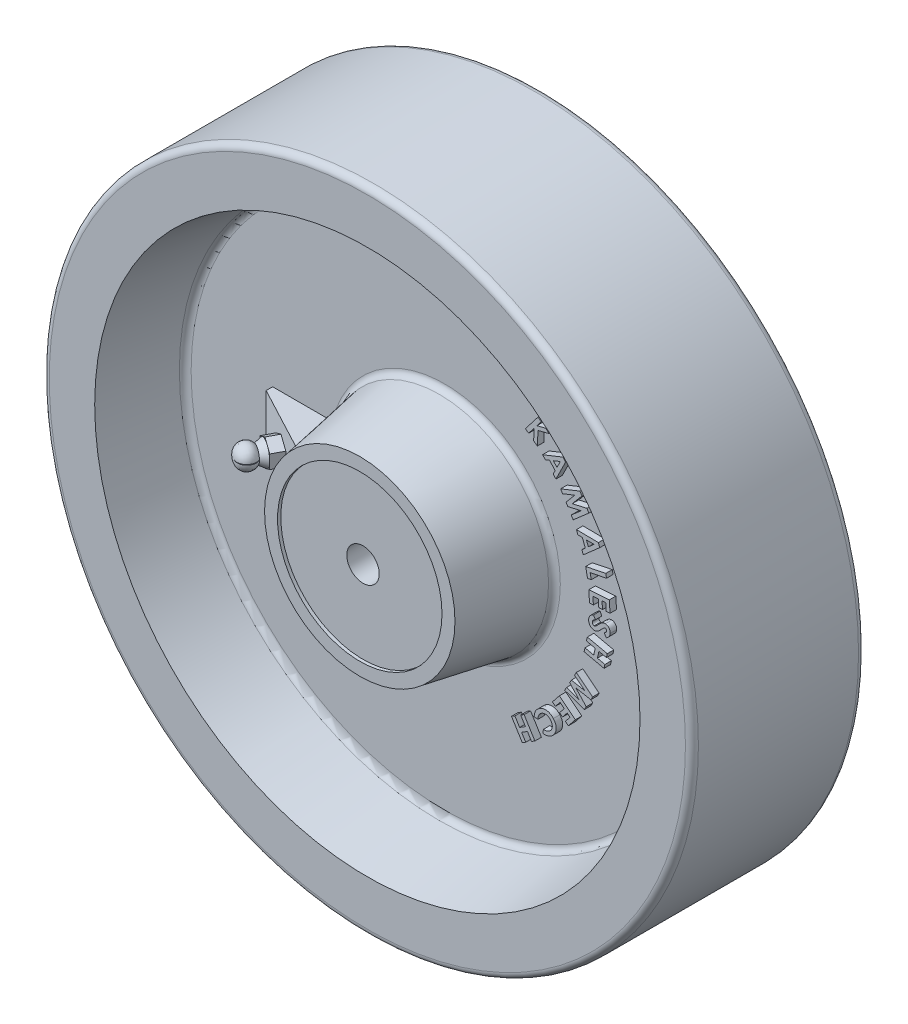
from build123d import *

# Parameters (mm, degrees)
SKETCH1_R           = 150
SKETCH1_R_2         = 138
BOSS_EXTRUDE1_DEPTH = 80
FILLET1_R           = 3
BOSS_EXTRUDE2_DEPTH = 12.5
BOSS_EXTRUDE3_DEPTH = 5.5
SKETCH6_R           = 5.419048207
BOSS_EXTRUDE4_DEPTH = 3
BOSS_EXTRUDE4_TAPER = 30
REVOLVE10_ANGLE     = 197
REVOLVE16_ANGLE     = 160
FILLET2_R           = 3
SKETCH9_R           = 7.5
CUT_EXTRUDE1_DEPTH  = 200
BOSS_EXTRUDE5_DEPTH = 3
SCALE1_SCALE        = 0.25


with BuildPart() as part:
    # Sketch1 → Boss-Extrude1 (new body)
    with BuildSketch(Plane.XY):
        Circle(SKETCH1_R)
        Circle(SKETCH1_R_2, mode=Mode.SUBTRACT)
    extrude(amount=BOSS_EXTRUDE1_DEPTH)

    # Fillet1
    fillet1_edges = [part.edges().sort_by_distance(p)[0] for p in [
        (-150, 0, 0),
        (-150, 0, 80),
    ]]
    fillet(fillet1_edges, radius=FILLET1_R)

    # Sketch2 → Revolve1 (revolve)
    with BuildSketch(Plane(origin=(0, 0, 0), x_dir=(1, 0, 0), z_dir=(0, 1, 0)), mode=Mode.PRIVATE) as revolve1_sk:
        Polygon((0, 2), (0, -82), (-38, -82), (-38, -83.5), (-44, -83.5), (-50.920833993, -44.25), (-119.69631044, -44.25), (-126, -80), (-138, -80), (-138, 0), (-126, 0), (-119.69631044, -35.75), (-50.920833993, -35.75), (-44, 3.5), (-38, 3.5), (-38, 2), align=None)
    revolve(revolve1_sk.sketch.rotate(Axis((0, 0, 132.461100462), (0, 0, -1)), 180), axis=Axis((0, 0, 132.461100462), (0, 0, -1)))

    # Sketch4 → Boss-Extrude2 (add, symmetric)
    with BuildSketch(Plane(origin=(0, 0, 0), x_dir=(1, 0, 0), z_dir=(0, 1, 0))):
        Polygon((-44.526638001, -64.25), (-44.526638001, -44.25), (-79.526638001, -44.25), (-79.526638001, -47.25), (-47.526638001, -64.25), align=None)
    extrude(amount=BOSS_EXTRUDE2_DEPTH, both=True)

    # Sketch5 → Boss-Extrude3 (add)
    with BuildSketch(Plane(origin=(-37.080882241, 0, 69.799307748), x_dir=(0.8831157194574106, 0, 0.46915522596174936), z_dir=(-0.4691552259617493, 0, 0.8831157194574105))):
        Polygon((-31.46224282, -6.257377882), (-26.043194613, -3.128688941), (-26.043194613, 3.128688941), (-31.46224282, 6.257377882), (-36.881291027, 3.128688941), (-36.881291027, -3.128688941), align=None)
    extrude(amount=BOSS_EXTRUDE3_DEPTH)

    # Sketch6 → Boss-Extrude4 (add)
    with BuildSketch(Plane(origin=(-39.661235984, 0, 74.656444205), x_dir=(0.8831157194574106, 0, 0.4691552259617493), z_dir=(-0.4691552259617493, 0, 0.8831157194574106))):
        with Locations((-31.46224282, 0)):
            Circle(SKETCH6_R)
    extrude(amount=BOSS_EXTRUDE4_DEPTH, taper=BOSS_EXTRUDE4_TAPER)

    # Sketch7 → Revolve10 (revolve)
    with BuildSketch(Plane(origin=(0, 0, 0), x_dir=(1, 0, 0), z_dir=(0, 1, 0))):
        with BuildLine():
            Line((-72.53953199, -69.42641392), (-68.871282287, -62.562602657))
            Line((-68.871282287, -62.562602657), (-65.597457504, -64.274889822))
            ThreePointArc((-65.597457504, -64.274889822), (-67.072987515, -69.53975117), (-72.53953199, -69.42641392))
        make_face()
    revolve(axis=Axis((-72.53953199, 0, 69.42641392), (0.4713433829073323, 0, -0.8819497805371187)), revolution_arc=REVOLVE10_ANGLE)

    # Sketch8 → Revolve16 (revolve)
    with BuildSketch(Plane(origin=(-2.356133559, -8.738100275, -1.25919637), x_dir=(0.9661830492283396, -0.2552208191231726, -0.036778375031050574), z_dir=(0.25785716081549453, 0.9563047559630309, 0.13780746837040567))):
        with BuildLine():
            Line((-70.673298822, -60.878690402), (-72.048151549, -60.114622764))
            Line((-72.048151549, -60.114622764), (-72.048489072, -60.093988268))
            Line((-72.048489072, -60.093988268), (-72.052128514, -60.091911553))
            ThreePointArc((-72.052128514, -60.091911553), (-75.686871824, -64.176589619), (-72.639856896, -68.716595551))
            Line((-72.639856896, -68.716595551), (-68.843216388, -61.922960162))
            Line((-68.843216388, -61.922960162), (-70.673298822, -60.878690402))
        make_face()
    revolve(axis=Axis((-72.53953199, 0, 69.42641392), (0.47134338290733374, 0, -0.881949780537118)), revolution_arc=REVOLVE16_ANGLE)

    # Fillet2
    fillet2_edges = [part.edges().sort_by_distance(p)[0] for p in [
        (-50.920833993, 0, 35.75),
        (-119.69631044, 0, 35.75),
        (6.298365223, 50.52981229, 44.25),
        (-119.69631044, 0, 44.25),
    ]]
    fillet(fillet2_edges, radius=FILLET2_R)

    # Sketch9 → Cut-Extrude1 (cut)
    with BuildSketch(Plane.XY.offset(82)):
        Circle(SKETCH9_R)
    extrude(amount=-CUT_EXTRUDE1_DEPTH, mode=Mode.SUBTRACT)

    # Sketch10 → Boss-Extrude5 (add)
    # profile 1 of 12: a face of its own
    with BuildSketch(Plane.XY.offset(44.25)):
        Polygon((46.12988392, 64.697056438), (47.580004112, 63.5808455), (45.580364689, 60.985893577), (49.627344857, 62.002885765), (51.354132718, 60.672972904), (46.127975867, 59.339243938), (45.801698823, 52.932002351), (44.09971565, 54.242834683), (44.349670578, 59.38694526), (41.769983078, 56.038312448), (40.319862886, 57.154523385), align=None)
    # profile 2 of 12: a face of its own
    with BuildSketch(Plane.XY.offset(44.25)):
        Polygon((57.636391852, 54.418739282), (58.868994015, 53.08119421), (54.40033416, 44.019851061), (53.135295097, 45.389833032), (54.062608799, 47.248276542), (51.454300506, 50.074102864), (49.504270458, 49.32423808), (48.241139448, 50.694220051), align=None)
        Polygon((56.422870217, 52.045121494), (53.192536684, 50.77245022), (54.892611804, 48.929271133), align=None, mode=Mode.SUBTRACT)
    # profile 3 of 12: a face of its own
    with BuildSketch(Plane.XY.offset(44.25)):
        Polygon((65.484975331, 44.740310882), (66.406564874, 43.236765209), (61.920732542, 37.922837925), (68.707676653, 39.479809079), (69.615909826, 37.997251987), (62.380573288, 31.693045257), (61.472340115, 33.175602348), (66.038310667, 37.16534093), (59.88865622, 35.759105954), (59.058653215, 37.113823502), (63.117081701, 41.931657035), (57.48069348, 39.691602949), (56.562920042, 41.189424463), align=None)
    # profile 4 of 12: a face of its own
    with BuildSketch(Plane.XY.offset(44.25)):
        Polygon((74.010946831, 28.415197085), (74.644420389, 26.703673647), (67.046553802, 20.01785634), (66.397815821, 21.769448888), (67.966235292, 23.137522806), (66.62869022, 26.751374969), (64.537464259, 26.799076291), (63.888726278, 28.55066884), align=None)
        Polygon((71.984594667, 26.676960907), (68.506214259, 26.734202493), (69.376286374, 24.379665234), align=None, mode=Mode.SUBTRACT)
    # profile 5 of 12: a face of its own
    with BuildSketch(Plane.XY.offset(44.25)):
        Polygon((77.431473008, 17.800497905), (77.795911109, 16.031732881), (70.184688152, 14.469037569), (70.713218801, 11.889350069), (69.026500051, 11.542084444), (68.133531301, 15.890536968), align=None)
    # profile 6 of 12: a face of its own
    with BuildSketch(Plane.XY.offset(44.25)):
        Polygon((79.045425857, 7.995475657), (79.415588117, 2.822744287), (77.650639199, 2.696812796), (77.408316482, 6.077882508), (75.694884992, 5.95385907), (75.937207708, 2.572789359), (74.204695689, 2.448765921), (73.962372973, 5.829835633), (71.470455906, 5.652386715), (71.712778622, 2.271317003), (69.942105545, 2.14347746), (69.571943285, 7.31620883), align=None)
    # profile 7 of 12: a face of its own
    with BuildSketch(Plane.XY.offset(44.25)):
        with BuildLine():
            Line((77.771690175, -7.845774784), (76.682191978, -6.435723702))
            add(Edge.make_bspline(
                [(76.682191978, -6.435723702), (76.763141698, -6.383467816), (76.919152498, -6.282757368), (77.130619596, -6.119096653), (77.312618114, -5.952873619), (77.461815025, -5.781934871), (77.58544213, -5.610544167), (77.672657971, -5.43264833), (77.736542383, -5.253581525), (77.749843763, -5.130475177), (77.756425752, -5.069557836)],
                knots=[0, 0, 0, 0, 1.281906111, 2.470560694, 3.55479556, 4.556585826, 5.486560015, 6.357279143, 7.187124073, 8, 8, 8, 8], degree=3))
            add(Edge.make_bspline(
                [(77.756425752, -5.069557836), (77.758594198, -5.012825071), (77.762765435, -4.903693558), (77.733748055, -4.746622977), (77.685768005, -4.60228212), (77.608359597, -4.477839339), (77.518149358, -4.374034769), (77.419441451, -4.291457772), (77.308586513, -4.239686266), (77.230275276, -4.229376508), (77.191642098, -4.224290409)],
                knots=[0, 0, 0, 0, 1.209038723, 2.325714675, 3.39122673, 4.439628025, 5.431311472, 6.320253696, 7.17133301, 8, 8, 8, 8], degree=3))
            add(Edge.make_bspline(
                [(77.191642098, -4.224290409), (77.152080777, -4.223376774), (77.072855376, -4.221547132), (76.955194349, -4.247015021), (76.837972445, -4.287971757), (76.766673949, -4.332813576), (76.7298933, -4.355946058)],
                knots=[0, 0, 0, 0, 0.968199431, 1.938913669, 2.936750471, 4, 4, 4, 4], degree=3))
            add(Edge.make_bspline(
                [(76.7298933, -4.355946058), (76.701017801, -4.376604631), (76.633913829, -4.424613233), (76.52689646, -4.515279852), (76.395834694, -4.629667088), (76.246678348, -4.774632093), (76.070993517, -4.941041172), (75.873633474, -5.134258703), (75.657410053, -5.356250261), (75.504947201, -5.512250444), (75.424785127, -5.59427238)],
                knots=[0, 0, 0, 0, 0.472993008, 1.099191739, 1.867856494, 2.7911666, 3.87026272, 5.092995224, 6.471552054, 8, 8, 8, 8], degree=3))
            add(Edge.make_bspline(
                [(75.424785127, -5.59427238), (75.351016653, -5.671239451), (75.210641858, -5.817700891), (75.01098989, -6.025717583), (74.831758144, -6.208404175), (74.674564941, -6.367304826), (74.540134284, -6.503221241), (74.42481166, -6.613000913), (74.334355647, -6.702051193), (74.278856451, -6.750741738), (74.255148709, -6.77154101)],
                knots=[0, 0, 0, 0, 1.541485479, 2.933308739, 4.168892309, 5.241859356, 6.165244342, 6.932674467, 7.544067657, 8, 8, 8, 8], degree=3))
            add(Edge.make_bspline(
                [(74.255148709, -6.77154101), (74.15892425, -6.85115912), (73.974316654, -7.003907269), (73.691665376, -7.201477225), (73.417444297, -7.359924396), (73.148921673, -7.481751061), (72.877926762, -7.56455767), (72.601693016, -7.617803455), (72.315710809, -7.644396393), (72.122606475, -7.636220768), (72.024634887, -7.63207286)],
                knots=[0, 0, 0, 0, 1.21794336, 2.336636635, 3.359343804, 4.303619165, 5.20631811, 6.116448548, 7.044379151, 8, 8, 8, 8], degree=3))
            add(Edge.make_bspline(
                [(72.024634887, -7.63207286), (71.929544889, -7.624100002), (71.742982045, -7.608457567), (71.473013865, -7.547787299), (71.214727761, -7.471819066), (70.972575076, -7.365214779), (70.742617403, -7.237910907), (70.531509003, -7.080856045), (70.330277015, -6.904708638), (70.14706769, -6.703490769), (69.983427144, -6.482939142), (69.843291507, -6.247041165), (69.728385711, -5.997618712), (69.637906701, -5.734299172), (69.574420471, -5.457187486), (69.531249811, -5.167025756), (69.51632392, -4.86285523), (69.525913597, -4.65611971), (69.530809767, -4.550567452)],
                knots=[0, 0, 0, 0, 1.028480388, 2.017838153, 2.979578233, 3.929416991, 4.86667587, 5.80974633, 6.76270411, 7.748819165, 8.739865599, 9.721504437, 10.704150403, 11.69818657, 12.720327328, 13.767596371, 14.860209194, 16, 16, 16, 16], degree=3))
            add(Edge.make_bspline(
                [(69.530809767, -4.550567452), (69.538136488, -4.467785087), (69.552562333, -4.30479193), (69.590212299, -4.064685468), (69.646500042, -3.834382956), (69.714062623, -3.612526116), (69.798979306, -3.400925006), (69.899028132, -3.198837965), (70.010079008, -3.002973909), (70.142034379, -2.819506832), (70.287284872, -2.642884906), (70.449633348, -2.474680715), (70.631080686, -2.315729124), (70.828384033, -2.163612519), (71.04418511, -2.020623348), (71.274785304, -1.882102149), (71.524921889, -1.755316756), (71.699270741, -1.678160851), (71.788036329, -1.63887875)],
                knots=[0, 0, 0, 0, 1.02030464, 2.00891428, 2.980630281, 3.929160724, 4.854386028, 5.776441839, 6.696676876, 7.615419504, 8.547344192, 9.502825546, 10.482137711, 11.506826417, 12.559494208, 13.659088357, 14.808180281, 16, 16, 16, 16], degree=3))
            Line((71.788036329, -1.63887875), (72.600866858, -3.214930433))
            add(Edge.make_bspline(
                [(72.600866858, -3.214930433), (72.498254693, -3.264841583), (72.301928643, -3.36033571), (72.033180427, -3.522928424), (71.802070121, -3.693756459), (71.610595871, -3.876171609), (71.457142614, -4.06825595), (71.342851966, -4.270079802), (71.26661308, -4.482053791), (71.249153915, -4.628224922), (71.240425151, -4.70130363)],
                knots=[0, 0, 0, 0, 1.293606771, 2.475035081, 3.557038834, 4.54676838, 5.466040082, 6.334823143, 7.16748969, 8, 8, 8, 8], degree=3))
            add(Edge.make_bspline(
                [(71.240425151, -4.70130363), (71.238262014, -4.775890247), (71.234050079, -4.921120989), (71.274605365, -5.131441005), (71.345007393, -5.326960241), (71.451645277, -5.50014442), (71.581403017, -5.646802478), (71.728460511, -5.758022116), (71.889793293, -5.83398882), (72.004784179, -5.84967178), (72.062795944, -5.857583678)],
                knots=[0, 0, 0, 0, 1.138592256, 2.217000917, 3.254595354, 4.302677918, 5.308810827, 6.233275046, 7.108704736, 8, 8, 8, 8], degree=3))
            add(Edge.make_bspline(
                [(72.062795944, -5.857583678), (72.117020213, -5.858397777), (72.227279979, -5.860053169), (72.394001207, -5.822745401), (72.560902862, -5.756093615), (72.701395366, -5.678312221), (72.818771087, -5.59458627), (72.92147758, -5.514638911), (73.035724366, -5.416869174), (73.161523697, -5.302142014), (73.298850151, -5.170346768), (73.447540322, -5.020709404), (73.609807926, -4.855379582), (73.720479578, -4.737769515), (73.778135488, -4.676498942)],
                knots=[0, 0, 0, 0, 0.907128202, 1.844556818, 2.841137064, 3.915758705, 4.528468584, 5.258350298, 6.098507244, 7.050156569, 8.11413286, 9.29103176, 10.588725961, 12, 12, 12, 12], degree=3))
            add(Edge.make_bspline(
                [(73.778135488, -4.676498942), (73.88754572, -4.559509237), (74.097723013, -4.334771759), (74.410272286, -4.020693717), (74.698655798, -3.735202277), (74.96935732, -3.485366504), (75.219591834, -3.269162128), (75.448419506, -3.084586495), (75.657747818, -2.933188463), (75.905380356, -2.777378481), (76.202253662, -2.629827793), (76.557052021, -2.510069223), (76.909302218, -2.44406936), (77.141790585, -2.44790732), (77.256515896, -2.449801226)],
                knots=[0, 0, 0, 0, 1.351397201, 2.596036942, 3.738257078, 4.775013305, 5.703402554, 6.52807202, 7.25482739, 7.881677223, 8.995237569, 10.042275653, 11.033927856, 12, 12, 12, 12], degree=3))
            add(Edge.make_bspline(
                [(77.256515896, -2.449801226), (77.336947903, -2.456767148), (77.496035732, -2.470545163), (77.727440947, -2.524853635), (77.950584127, -2.595404517), (78.160907007, -2.695241977), (78.363439162, -2.812649265), (78.551920433, -2.958127095), (78.733267076, -3.122844739), (78.900403803, -3.310233391), (79.052551119, -3.512718252), (79.183223479, -3.727347836), (79.290006501, -3.952149053), (79.377266936, -4.185264789), (79.437749228, -4.428694814), (79.475294296, -4.681018843), (79.494378181, -4.942828125), (79.485712331, -5.120436209), (79.48130556, -5.21075375)],
                knots=[0, 0, 0, 0, 0.980880199, 1.940099567, 2.884539061, 3.822650528, 4.76610704, 5.727072259, 6.712822797, 7.742823146, 8.776507518, 9.790280839, 10.793875962, 11.799973225, 12.813303573, 13.838614598, 14.900888918, 16, 16, 16, 16], degree=3))
            add(Edge.make_bspline(
                [(79.48130556, -5.21075375), (79.469630412, -5.327619725), (79.446471478, -5.559436192), (79.359236002, -5.899558674), (79.233537377, -6.228241796), (79.093512464, -6.492007363), (78.960750855, -6.699466322), (78.840444099, -6.856234539), (78.705301203, -7.01649591), (78.552173426, -7.178660837), (78.381304958, -7.342566108), (78.195300492, -7.510606079), (77.989721645, -7.678388969), (77.845759874, -7.788910438), (77.771690175, -7.845774784)],
                knots=[0, 0, 0, 0, 1.298415062, 2.575548552, 3.872474189, 5.185615111, 5.872958805, 6.596653783, 7.370933703, 8.192660428, 9.06391689, 9.99113918, 10.966422031, 12, 12, 12, 12], degree=3))
        make_face()
    # profile 8 of 12: a face of its own
    with BuildSketch(Plane.XY.offset(44.25)):
        Polygon((78.123514967, -13.992439816), (77.726639967, -15.770745104), (74.252075664, -14.99416758), (73.563268573, -18.073764936), (77.037832876, -18.85034246), (76.640957876, -20.62292359), (67.430786602, -18.564134528), (67.827661602, -16.791553398), (71.865101506, -17.694062412), (72.553908597, -14.614465056), (68.516468693, -13.711956042), (68.913343693, -11.933650754), align=None)
    # profile 9 of 12: a face of its own
    with BuildSketch(Plane.XY.offset(44.25)):
        Polygon((71.372056092, -34.667732225), (70.522972558, -36.220887273), (63.657798279, -34.965388475), (68.399309698, -40.099958787), (67.561674481, -41.630217201), (58.460262222, -38.474297729), (59.297897438, -36.945947369), (65.048768832, -38.932230422), (60.757557895, -34.276581383), (61.524595154, -32.877978619), (67.744847558, -34.009453979), (62.980439505, -30.216244845), (63.827614986, -28.668813955), align=None)
    # profile 10 of 12: a face of its own
    with BuildSketch(Plane.XY.offset(44.25)):
        Polygon((63.382466431, -47.804229212), (60.161673162, -51.826404693), (58.789783138, -50.727366232), (60.898181576, -48.096161304), (59.566360662, -47.029559741), (57.457962225, -49.660764669), (56.110876888, -48.582714789), (58.219275326, -45.951509861), (56.280693595, -44.398354813), (54.172295157, -47.029559741), (52.794680975, -45.926705174), (56.015474244, -41.904529693), align=None)
    # profile 11 of 12: a face of its own
    with BuildSketch(Plane.XY.offset(44.25)):
        with BuildLine():
            Line((48.44947647, -60.788372142), (48.583040172, -59.055860123))
            add(Edge.make_bspline(
                [(48.583040172, -59.055860123), (48.734378677, -59.06439973), (49.030127208, -59.08108799), (49.46501119, -59.058225708), (49.880121168, -59.002926809), (50.274149477, -58.905387179), (50.647765061, -58.768996451), (50.999291662, -58.594594156), (51.332634668, -58.384315665), (51.53288095, -58.214375758), (51.634016734, -58.128546421)],
                knots=[0, 0, 0, 0, 1.107709041, 2.164705692, 3.178946563, 4.165960249, 5.126765548, 6.081472872, 7.031034468, 8, 8, 8, 8], degree=3))
            add(Edge.make_bspline(
                [(51.634016734, -58.128546421), (51.714294663, -58.052339475), (51.872159097, -57.902480521), (52.081450439, -57.656999435), (52.259334848, -57.397125658), (52.411933311, -57.126937675), (52.529629945, -56.841022729), (52.622610983, -56.545145808), (52.682893386, -56.235385357), (52.715465418, -55.917287541), (52.716526527, -55.597320822), (52.691703304, -55.282520708), (52.630760877, -54.978055392), (52.543969383, -54.681846349), (52.421775804, -54.396043722), (52.270684378, -54.119701585), (52.091027272, -53.851053079), (51.948762574, -53.686443353), (51.876339451, -53.602644979)],
                knots=[0, 0, 0, 0, 1.050584987, 2.06594773, 3.056010854, 4.037396755, 5.006496499, 5.986469049, 6.977839163, 7.997646625, 9.018329989, 10.012400663, 10.990752791, 11.961432039, 12.938441096, 13.935698901, 14.949119946, 16, 16, 16, 16], degree=3))
            add(Edge.make_bspline(
                [(51.876339451, -53.602644979), (51.823506667, -53.54609613), (51.718753925, -53.433975463), (51.553390732, -53.278163358), (51.382671219, -53.135975422), (51.206799753, -53.00780396), (51.025204788, -52.89292878), (50.838192465, -52.792053744), (50.646564374, -52.703578709), (50.386854725, -52.605127375), (50.053011175, -52.518089623), (49.644077962, -52.465735997), (49.229277979, -52.480480003), (48.883969744, -52.534134789), (48.611344698, -52.608919122), (48.40777662, -52.674517376), (48.210478849, -52.75774913), (48.016093061, -52.850218158), (47.829682358, -52.960783956), (47.645827424, -53.080206193), (47.467628788, -53.21446946), (47.354334308, -53.312587243), (47.297012528, -53.362230315)],
                knots=[0, 0, 0, 0, 0.903366238, 1.791124441, 2.650606422, 3.495726035, 4.330076843, 5.157392751, 5.974751338, 6.792582017, 8.397376176, 9.99077406, 11.587904937, 13.227421668, 14.057797778, 14.886711722, 15.722383228, 16.555973687, 17.397824724, 18.250479178, 19.114823172, 20, 20, 20, 20], degree=3))
            add(Edge.make_bspline(
                [(47.297012528, -53.362230315), (47.203953528, -53.449900938), (47.021005722, -53.622255554), (46.786565467, -53.91162188), (46.585649431, -54.214432449), (46.449106874, -54.483018955), (46.35705865, -54.709779372), (46.296397187, -54.893454474), (46.242656296, -55.09085678), (46.198276766, -55.302032549), (46.157246159, -55.526421287), (46.125302914, -55.7652139), (46.101026331, -56.017957518), (46.089417198, -56.191203474), (46.083490893, -56.279643176)],
                knots=[0, 0, 0, 0, 1.411876372, 2.775655055, 4.105505268, 5.422920595, 6.097879533, 6.809310127, 7.559725302, 8.358137033, 9.193843264, 10.080738324, 11.020243049, 12, 12, 12, 12], degree=3))
            Line((46.083490893, -56.279643176), (44.326174186, -56.151803632))
            add(Edge.make_bspline(
                [(44.326174186, -56.151803632), (44.3349536, -56.032802286), (44.352115551, -55.800179101), (44.390068428, -55.460202541), (44.439255583, -55.137372083), (44.500504565, -54.831934237), (44.570925744, -54.543496057), (44.65024856, -54.271684728), (44.742247777, -54.017811922), (44.843931734, -53.777826028), (44.960311748, -53.549334167), (45.087759136, -53.325033698), (45.232356177, -53.105945987), (45.387475279, -52.887835035), (45.561122362, -52.675805886), (45.747004673, -52.466393987), (45.948561202, -52.261711683), (46.090002036, -52.129755856), (46.161721061, -52.062846301)],
                knots=[0, 0, 0, 0, 1.239904762, 2.423759092, 3.553868309, 4.632295093, 5.659819954, 6.638528824, 7.573058283, 8.46433111, 9.345152231, 10.236253501, 11.143676308, 12.07180344, 13.016282896, 13.989980056, 14.980798772, 16, 16, 16, 16], degree=3))
            add(Edge.make_bspline(
                [(46.161721061, -52.062846301), (46.29774278, -51.945844614), (46.564787496, -51.716140985), (46.992188016, -51.420629037), (47.428872487, -51.171765056), (47.877644239, -50.973939769), (48.337438209, -50.826047451), (48.807655406, -50.728834684), (49.287734968, -50.678281247), (49.774151036, -50.679749133), (50.258439123, -50.725322211), (50.730513118, -50.824466213), (51.186903454, -50.967233817), (51.6272143, -51.159501251), (52.049740949, -51.402198533), (52.457646848, -51.689676345), (52.849571201, -52.024375982), (53.088370146, -52.278629527), (53.210068417, -52.408203873)],
                knots=[0, 0, 0, 0, 1.086810029, 2.133680404, 3.143494199, 4.12903079, 5.100627712, 6.065294791, 7.034188605, 8.021013474, 9.008696263, 9.977137547, 10.93905115, 11.902292339, 12.882931674, 13.887167812, 14.923244722, 16, 16, 16, 16], degree=3))
            add(Edge.make_bspline(
                [(53.210068417, -52.408203873), (53.286202681, -52.495717827), (53.436578975, -52.668570674), (53.6410715, -52.940804116), (53.824224942, -53.218519859), (53.985336998, -53.503208375), (54.127058388, -53.792505838), (54.246376852, -54.08951265), (54.340342215, -54.393250102), (54.417579864, -54.700688773), (54.473126732, -55.011728283), (54.505765038, -55.325486788), (54.51476626, -55.641126179), (54.503301497, -55.957888288), (54.471013399, -56.276736732), (54.415005961, -56.596498273), (54.338828877, -56.918569824), (54.239364474, -57.238680867), (54.122378916, -57.554691914), (53.98418143, -57.860079113), (53.829793659, -58.155087836), (53.655698618, -58.438114404), (53.462402711, -58.70903102), (53.252622709, -58.96878521), (53.024480361, -59.21683458), (52.85998404, -59.371060337), (52.776940412, -59.448919017)],
                knots=[0, 0, 0, 0, 1.060556804, 2.094754633, 3.111116571, 4.10096807, 5.084303932, 6.055331274, 7.024824331, 7.989770022, 8.952767797, 9.911804956, 10.871987971, 11.838177567, 12.808786708, 13.80043103, 14.80493975, 15.833429535, 16.8641374, 17.88468506, 18.896793826, 19.90736372, 20.920942264, 21.938368874, 22.959214857, 24, 24, 24, 24], degree=3))
            add(Edge.make_bspline(
                [(52.776940412, -59.448919017), (52.703832519, -59.512690501), (52.558237057, -59.639692364), (52.328233839, -59.815546629), (52.089706674, -59.977495021), (51.843306359, -60.126716295), (51.588197599, -60.262288811), (51.325894184, -60.38686658), (51.053978425, -60.495066555), (50.775961005, -60.590852909), (50.492311332, -60.670420676), (50.205740208, -60.735359185), (49.917377277, -60.785693262), (49.626740065, -60.817542197), (49.335066961, -60.834736832), (49.041429545, -60.837038693), (48.745834247, -60.821834095), (48.548602057, -60.799564478), (48.44947647, -60.788372142)],
                knots=[0, 0, 0, 0, 0.996203305, 1.983953758, 2.971401757, 3.956145155, 4.940996879, 5.937457159, 6.936995975, 7.945100451, 8.95635351, 9.961065969, 10.961969985, 11.961081794, 12.962262888, 13.961737666, 14.975603569, 16, 16, 16, 16], degree=3))
        make_face()
    # profile 12 of 12: a face of its own
    with BuildSketch(Plane.XY.offset(44.25)):
        Polygon((44.686329532, -65.662779481), (43.127450325, -66.628254241), (41.240386022, -63.58490989), (38.542399243, -65.25827227), (40.429463546, -68.301616621), (38.876308498, -69.265183327), (33.871485782, -61.196027678), (35.42464083, -60.232460971), (37.618901647, -63.76999102), (40.316888426, -62.09662864), (38.122627609, -58.559098592), (39.681506815, -57.593623832), align=None)
    extrude(amount=BOSS_EXTRUDE5_DEPTH)


with BuildPart() as part_1:
    # Scale1: scaled about (-0.186013976, -0.001272022, 40.047166294)
    add(part.part.scale(SCALE1_SCALE).moved(Location((-0.139510482, -0.000954016, 30.035374721))))


solid = part_1.part
